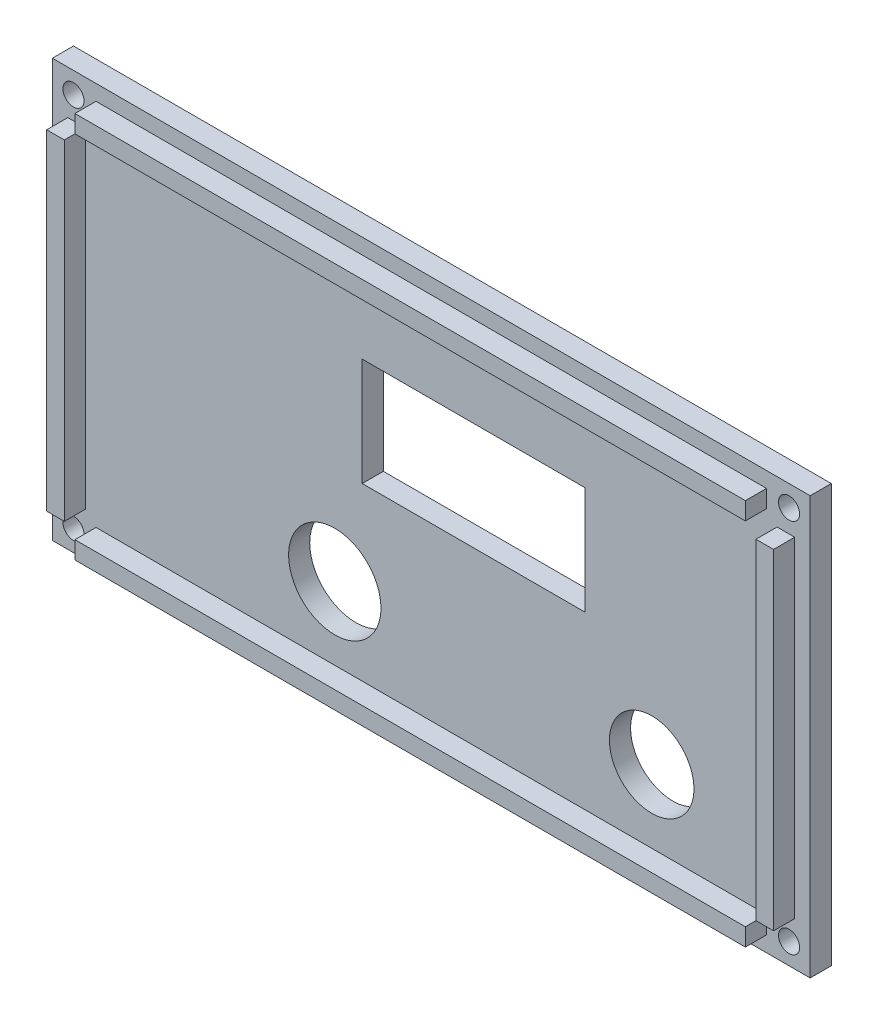
from build123d import *

# Parameters (mm, degrees)
SKETCH1_W           = 107.6
SKETCH1_H           = 59.3
BOSS_EXTRUDE1_DEPTH = 3
SKETCH2_W           = 95.2
SKETCH2_H           = 2.5
SKETCH2_W_2         = 2.5
SKETCH2_H_2         = 46.9
BOSS_EXTRUDE2_DEPTH = 3
SKETCH3_R           = 1.5
SKETCH3_R_2         = 6
SKETCH3_R_3         = 6.557552613
SKETCH3_W           = 31.6
SKETCH3_H           = 15.3
CUT_EXTRUDE1_DEPTH  = 5


with BuildPart() as part:
    # Sketch1 → Boss-Extrude1 (new body)
    with BuildSketch(Plane.XY):
        with Locations((53.8, 29.65)):
            Rectangle(SKETCH1_W, SKETCH1_H)
    extrude(amount=BOSS_EXTRUDE1_DEPTH)

    # Sketch2 → Boss-Extrude2 (add)
    with BuildSketch(Plane.XY.offset(3)):
        with Locations((53.8, 55.85)):
            Rectangle(SKETCH2_W, SKETCH2_H)
        with Locations((3.45, 29.65)):
            Rectangle(SKETCH2_W_2, SKETCH2_H_2)
        with Locations((53.8, 3.45)):
            Rectangle(SKETCH2_W, SKETCH2_H)
        with Locations((104.15, 29.65)):
            Rectangle(SKETCH2_W_2, SKETCH2_H_2)
    extrude(amount=BOSS_EXTRUDE2_DEPTH)

    # Sketch3 → Cut-Extrude1 (cut)
    with BuildSketch(Plane(origin=(0, 0, 0), x_dir=(-1, 0, 0), z_dir=(0, 0, -1))):
        with Locations((-104.6, 56.3)):
            Circle(SKETCH3_R)
        with Locations((-3, 56.3)):
            Circle(SKETCH3_R)
        with Locations((-3, 3)):
            Circle(SKETCH3_R)
        with Locations((-104.6, 3)):
            Circle(SKETCH3_R)
        with Locations((-85.1, 15)):
            Circle(SKETCH3_R_2)
        with Locations((-40.1, 15)):
            Circle(SKETCH3_R_3)
        with Locations((-59.8, 36.65)):
            Rectangle(SKETCH3_W, SKETCH3_H)
    extrude(amount=-CUT_EXTRUDE1_DEPTH, mode=Mode.SUBTRACT)


solid = part.part
